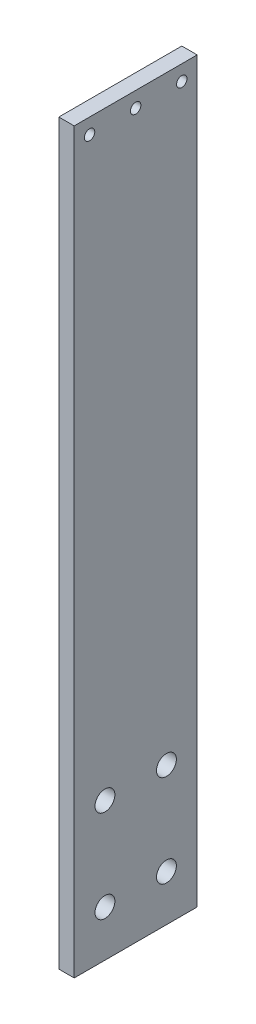
from build123d import *

# Parameters (mm, degrees)
SKETCH1_W           = 50.8
SKETCH1_H           = 304.8
BOSS_EXTRUDE1_DEPTH = 6.35
SKETCH2_R           = 4.1021
SKETCH2_R_2         = 2.15265
CUT_EXTRUDE1_DEPTH  = 155.632604906


with BuildPart() as part:
    # Sketch1 → Boss-Extrude1 (new body)
    with BuildSketch(Plane(origin=(0, 0, 0), x_dir=(0, 0, -1), z_dir=(1, 0, 0))):
        Rectangle(SKETCH1_W, SKETCH1_H)
    extrude(amount=-BOSS_EXTRUDE1_DEPTH)

    # Sketch2 → Cut-Extrude1 (cut, through all)
    with BuildSketch(Plane(origin=(0, 0, 0), x_dir=(0, 0, -1), z_dir=(1, 0, 0))):
        with Locations((-12.7, -95.25)):
            Circle(SKETCH2_R)
        with Locations((12.7, -95.25)):
            Circle(SKETCH2_R)
        with Locations((12.7, -133.35)):
            Circle(SKETCH2_R)
        with Locations((-12.7, -133.35)):
            Circle(SKETCH2_R)
        with Locations((-19.05, 146.05)):
            Circle(SKETCH2_R_2)
        with Locations((0, 146.05)):
            Circle(SKETCH2_R_2)
        with Locations((19.05, 146.05)):
            Circle(SKETCH2_R_2)
    extrude(amount=-CUT_EXTRUDE1_DEPTH, mode=Mode.SUBTRACT)


solid = part.part
